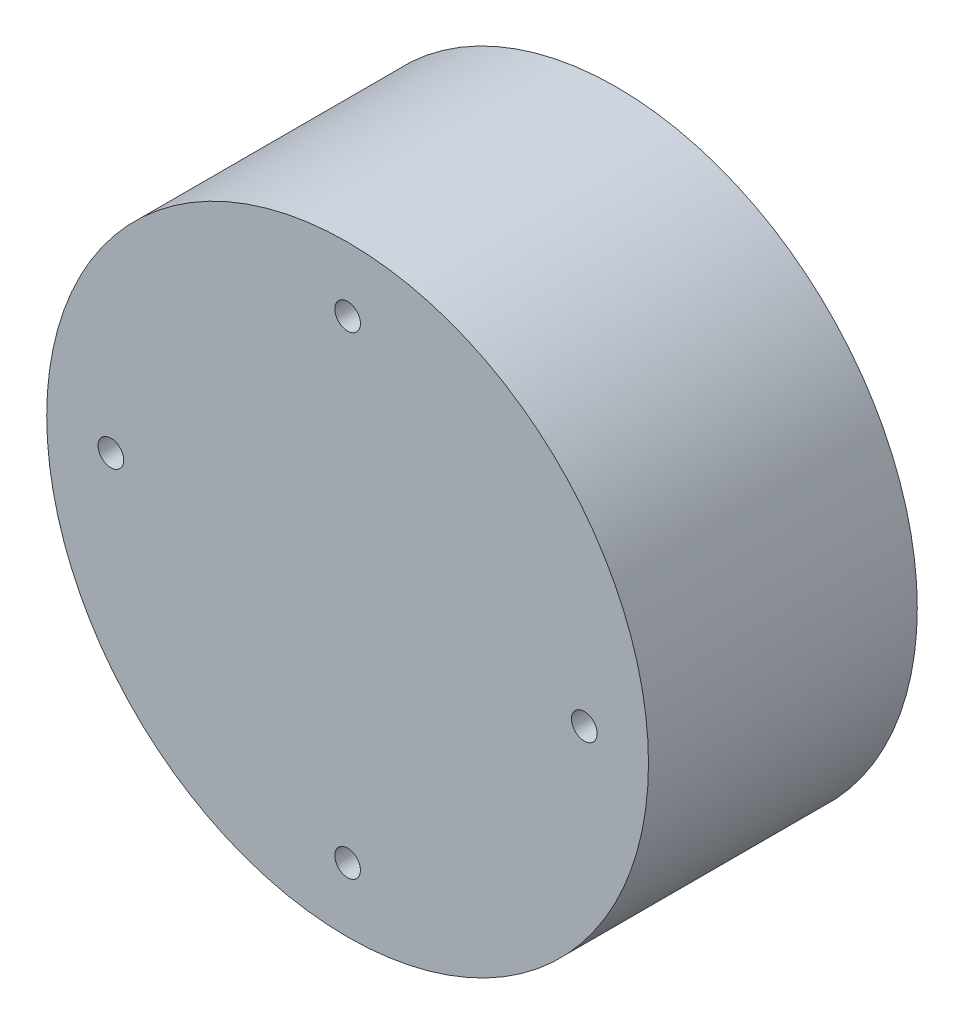
from build123d import *

# Parameters (mm, degrees)
ESQUISSE1_R             = 37.5
BOSS_EXTRU_1_DEPTH      = 33.5
ESQUISSE2_R             = 1.6
ENL_V_MAT_EXTRU_1_DEPTH = 63.727585638


with BuildPart() as part:
    # Esquisse1 → Boss.-Extru.1 (new body)
    with BuildSketch(Plane.XY):
        Circle(ESQUISSE1_R)
    extrude(amount=BOSS_EXTRU_1_DEPTH)

    # Esquisse2 → Enlèv. mat.-Extru.1 (cut, through all)
    with BuildSketch(Plane.XY.offset(33.5)):
        with Locations((0, 29.500989814)):
            Circle(ESQUISSE2_R)
        with Locations((29.5, 0)):
            Circle(ESQUISSE2_R)
        with Locations((-29.5, 0)):
            Circle(ESQUISSE2_R)
        with Locations((0, -29.500989814)):
            Circle(ESQUISSE2_R)
    extrude(amount=-ENL_V_MAT_EXTRU_1_DEPTH, mode=Mode.SUBTRACT)


solid = part.part
